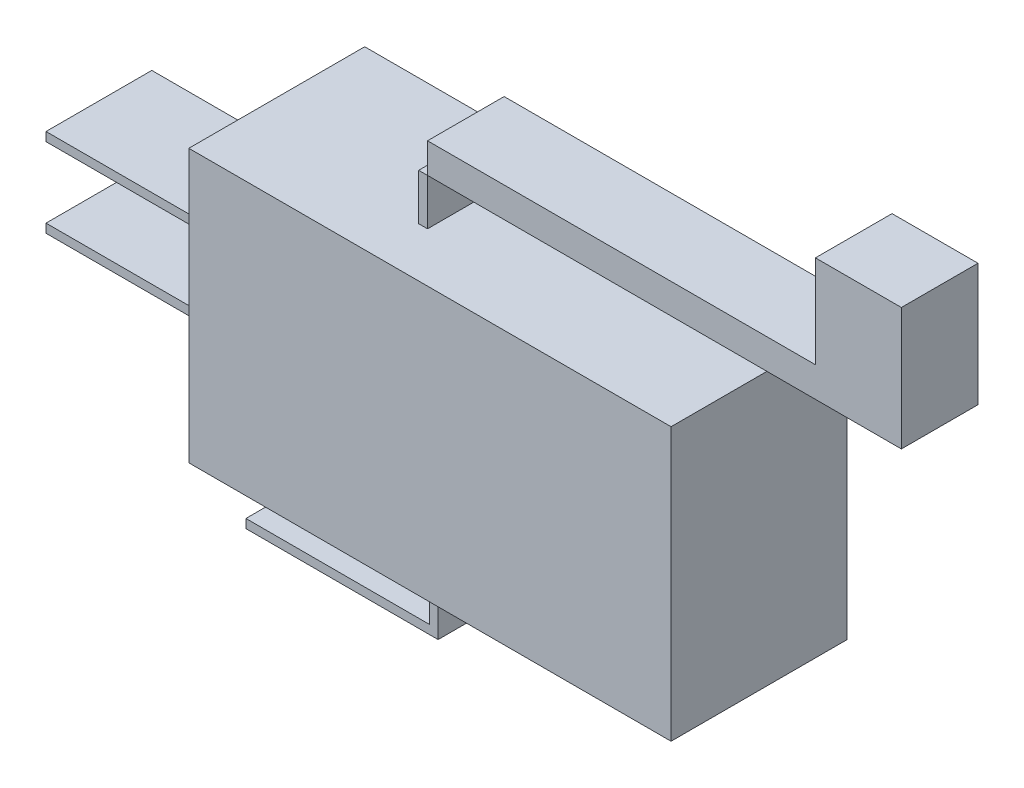
from build123d import *

# Parameters (mm, degrees)
SKETCH1_W           = 27.7876
SKETCH1_H           = 15.6972
BOSS_EXTRUDE1_DEPTH = 10.1346
SKETCH2_W           = 6.096
SKETCH2_H           = 0.508
BOSS_EXTRUDE2_DEPTH = 10.2616
SKETCH4_W           = 0.508
SKETCH4_H           = 4.4196
BOSS_EXTRUDE3_DEPTH = 2.667
SKETCH5_W           = 4.414586419
SKETCH5_H           = 7.0612
BOSS_EXTRUDE4_DEPTH = 27.305
SKETCH6_W           = 22.352
SKETCH6_H           = 4.414586419
CUT_EXTRUDE1_DEPTH  = 5.334
SKETCH7_W           = 0.508
SKETCH7_H           = 6.096
BOSS_EXTRUDE5_DEPTH = 3.6576
SKETCH8_W           = 6.096
SKETCH8_H           = 0.508
BOSS_EXTRUDE6_DEPTH = 10.5664


with BuildPart() as part:
    # Sketch1 → Boss-Extrude1 (new body)
    with BuildSketch(Plane.XY):
        with Locations((13.8938, 7.8486)):
            Rectangle(SKETCH1_W, SKETCH1_H)
    extrude(amount=BOSS_EXTRUDE1_DEPTH)

    # Sketch2 → Boss-Extrude2 (add)
    with BuildSketch(Plane.ZY):
        with Locations((5.0546, 10.1346)):
            Rectangle(SKETCH2_W, SKETCH2_H)
        with Locations((5.0546, 5.5626)):
            Rectangle(SKETCH2_W, SKETCH2_H)
    extrude(amount=BOSS_EXTRUDE2_DEPTH)

    # Sketch4 → Boss-Extrude3 (add)
    with BuildSketch(Plane(origin=(0, 15.6972, 0), x_dir=(1, 0, 0), z_dir=(0, 1, 0))):
        with Locations((10.6426, -5.0673)):
            Rectangle(SKETCH4_W, SKETCH4_H)
    extrude(amount=BOSS_EXTRUDE3_DEPTH)

    # Sketch7 → Boss-Extrude5 (add)
    with BuildSketch(Plane.XZ):
        with Locations((12.0904, 5.0673)):
            Rectangle(SKETCH7_W, SKETCH7_H)
    extrude(amount=BOSS_EXTRUDE5_DEPTH)

    # Sketch8 → Boss-Extrude6 (add)
    with BuildSketch(Plane.ZY.offset(-11.8364)):
        with Locations((5.0673, -3.4036)):
            Rectangle(SKETCH8_W, SKETCH8_H)
    extrude(amount=BOSS_EXTRUDE6_DEPTH)


with BuildPart() as body_2:
    # Sketch5 → Boss-Extrude4 (new body)
    with BuildSketch(Plane(origin=(10.8966, 0, 0), x_dir=(0, 0, -1), z_dir=(1, 0, 0))):
        with Locations((-5.069806791, 21.8948)):
            Rectangle(SKETCH5_W, SKETCH5_H)
    extrude(amount=BOSS_EXTRUDE4_DEPTH)

    # Sketch6 → Cut-Extrude1 (cut)
    with BuildSketch(Plane(origin=(0, 25.4254, 0), x_dir=(1, 0, 0), z_dir=(0, 1, 0))):
        with Locations((22.0726, -5.069806791)):
            Rectangle(SKETCH6_W, SKETCH6_H)
    extrude(amount=-CUT_EXTRUDE1_DEPTH, mode=Mode.SUBTRACT)


solid = Compound([part.part, body_2.part])
